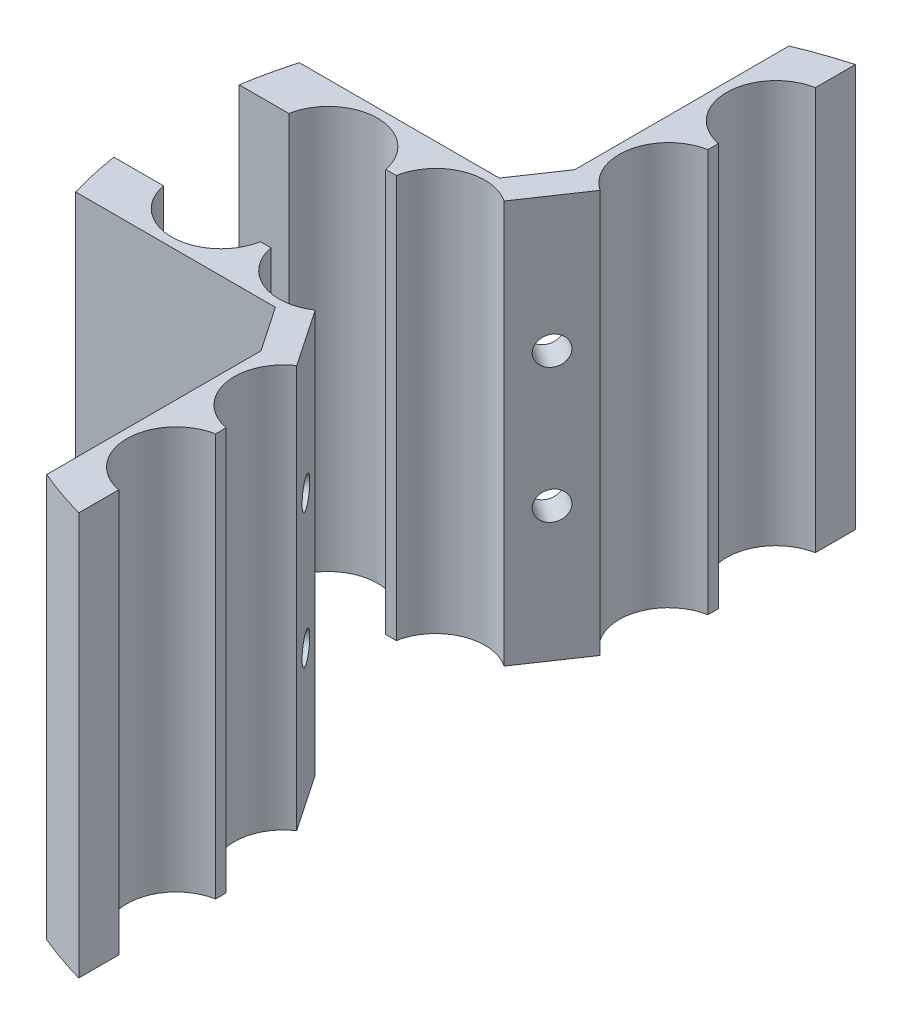
from build123d import *

# Parameters (mm, degrees)
BOSS_EXTRUDE2_DEPTH = 45
SKETCH2_R           = 5.5
CUT_EXTRUDE1_DEPTH  = 45
SKETCH3_W           = 11
SKETCH3_H           = 6
CUT_EXTRUDE2_DEPTH  = 45
SKETCH4_W           = 1
SKETCH4_H           = 1
CUT_EXTRUDE3_DEPTH  = 45
CUT_EXTRUDE4_DEPTH  = 45
SKETCH8_R           = 1.6
CUT_EXTRUDE5_DEPTH  = 45
SKETCH9_R           = 1.6
CUT_EXTRUDE6_DEPTH  = 45


with BuildPart() as part:
    # Sketch1 → Boss-Extrude2 (new body)
    with BuildSketch(Plane(origin=(0, 0, 0), x_dir=(1, 0, 0), z_dir=(0, 1, 0))):
        with BuildLine():
            Line((0, -45), (0, 45))
            ThreePointArc((0, 45), (-45, 0), (0, -45))
        make_face()
    extrude(amount=BOSS_EXTRUDE2_DEPTH)

    # Sketch2 → Cut-Extrude1 (cut)
    with BuildSketch(Plane(origin=(0, 45, 0), x_dir=(1, 0, 0), z_dir=(0, 1, 0))):
        with Locations(Location((-11, -21.5, 0), (0, 0, 270))):
            Circle(SKETCH2_R)
        with Locations(Location((-11, -33.5, 0), (0, 0, 270))):
            Circle(SKETCH2_R)
        with Locations(Location((-21.5, -6, 0), (0, 0, 270))):
            Circle(SKETCH2_R)
        with Locations(Location((-33.5, -6, 0), (0, 0, 270))):
            Circle(SKETCH2_R)
        with Locations(Location((-11, 33.5, 0), (0, 0, 270))):
            Circle(SKETCH2_R)
        with Locations(Location((-11, 21.5, 0), (0, 0, 270))):
            Circle(SKETCH2_R)
        with Locations(Location((-21.5, 6, 0), (0, 0, 270))):
            Circle(SKETCH2_R)
        with Locations(Location((-33.5, 6, 0), (0, 0, 270))):
            Circle(SKETCH2_R)
    extrude(amount=-CUT_EXTRUDE1_DEPTH, mode=Mode.SUBTRACT)

    # Sketch3 → Cut-Extrude2 (cut)
    with BuildSketch(Plane(origin=(0, 45, 0), x_dir=(1, 0, 0), z_dir=(0, 1, 0))):
        with BuildLine():
            Line((-11, 6), (0, 6))
            Line((0, 6), (0, 45))
            ThreePointArc((0, 45), (-5.54219358, 44.657408012), (-11, 43.634848459))
            Line((-11, 43.634848459), (-11, 39))
            ThreePointArc((-11, 39), (-7.110912703, 37.389087297), (-5.5, 33.5))
            ThreePointArc((-5.5, 33.5), (-7.110912703, 29.610912703), (-11, 28))
            Line((-11, 28), (-11, 27))
            ThreePointArc((-11, 27), (-7.110912703, 25.389087297), (-5.5, 21.5))
            ThreePointArc((-5.5, 21.5), (-7.110912703, 17.610912703), (-11, 16))
            Line((-11, 16), (-11, 6))
        make_face()
        with BuildLine():
            Line((0, -45), (0, -6))
            Line((0, -6), (-11, -6))
            Line((-11, -6), (-11, -16))
            ThreePointArc((-11, -16), (-7.110912703, -17.610912703), (-5.5, -21.5))
            ThreePointArc((-5.5, -21.5), (-7.110912703, -25.389087297), (-11, -27))
            Line((-11, -27), (-11, -28))
            ThreePointArc((-11, -28), (-7.110912703, -29.610912703), (-5.5, -33.5))
            ThreePointArc((-5.5, -33.5), (-7.110912703, -37.389087297), (-11, -39))
            Line((-11, -39), (-11, -43.634848459))
            ThreePointArc((-11, -43.634848459), (-5.54219358, -44.657408012), (0, -45))
        make_face()
        with BuildLine():
            Line((-11, -6), (-11, 0))
            Line((-11, 0), (-45, 0))
            ThreePointArc((-45, 0), (-44.8994392, -3.006719068), (-44.598206242, -6))
            Line((-44.598206242, -6), (-39, -6))
            ThreePointArc((-39, -6), (-33.5, -0.5), (-28, -6))
            Line((-28, -6), (-27, -6))
            ThreePointArc((-27, -6), (-21.5, -0.5), (-16, -6))
            Line((-16, -6), (-11, -6))
        make_face()
        with BuildLine():
            Line((-45, 0), (-11, 0))
            Line((-11, 0), (-11, 6))
            Line((-11, 6), (-16, 6))
            ThreePointArc((-16, 6), (-21.5, 0.5), (-27, 6))
            Line((-27, 6), (-28, 6))
            ThreePointArc((-28, 6), (-33.5, 0.5), (-39, 6))
            Line((-39, 6), (-44.598206242, 6))
            ThreePointArc((-44.598206242, 6), (-44.8994392, 3.006719068), (-45, 0))
        make_face()
        with Locations((-5.5, 3)):
            Rectangle(SKETCH3_W, SKETCH3_H)
        with Locations((-5.5, -3)):
            Rectangle(SKETCH3_W, SKETCH3_H)
    extrude(amount=-CUT_EXTRUDE2_DEPTH, mode=Mode.SUBTRACT)


with BuildPart() as cut_extrude2_piece_1:
    # of the separate pieces the step leaves, piece 1, a body of its own (cut_extrude2_pieces)
    add(part.part.solids().sort_by_distance((-44.598206242, 0, 6))[0])


with BuildPart() as cut_extrude2_piece_2:
    # of the separate pieces the step leaves, piece 2, a body of its own (cut_extrude2_pieces)
    add(part.part.solids().sort_by_distance((-11, 0, -43.634848459))[0])


with BuildPart() as cut_extrude3_tool:
    # Sketch4 → Cut-Extrude3 (new body)
    with BuildSketch(Plane(origin=(0, 45, 0), x_dir=(1, 0, 0), z_dir=(0, 1, 0))):
        Polygon((-48.017715624, 6), (-21.5, 6), (-20.822580645, 7), (-48.017715624, 7), align=None)
        Polygon((-20.822580645, 7), (-21.5, 6), (-12, 6), (-12, 7), align=None)
        Polygon((-12, 20.023809524), (-20.822580645, 7), (-12, 7), align=None)
        with Locations((-11.5, 6.5)):
            Rectangle(SKETCH4_W, SKETCH4_H)
        Polygon((-12, 46.611751928), (-12, 20.023809524), (-11, 21.5), (-11, 46.611751928), align=None)
        Polygon((-11, 21.5), (-12, 20.023809524), (-12, 7), (-11, 7), align=None)
        Polygon((-12, -46.611751928), (-11, -46.611751928), (-11, -21.5), (-12, -20.023809524), align=None)
        Polygon((-12, -20.023809524), (-11, -21.5), (-11, -7), (-12, -7), align=None)
        Polygon((-20.822580645, -7), (-12, -20.023809524), (-12, -7), align=None)
        with Locations((-11.5, -6.5)):
            Rectangle(SKETCH4_W, SKETCH4_H)
        Polygon((-20.822580645, -7), (-12, -7), (-12, -6), (-21.5, -6), align=None)
        Polygon((-48.017715624, -7), (-20.822580645, -7), (-21.5, -6), (-48.017715624, -6), align=None)
    extrude(amount=-CUT_EXTRUDE3_DEPTH)


with BuildPart() as cut_extrude2_piece_1_1:
    add(cut_extrude2_piece_1.part)

    # Cut-Extrude3: cut by cut_extrude3_tool
    add(cut_extrude3_tool.part, mode=Mode.SUBTRACT)


with BuildPart() as cut_extrude2_piece_2_1:
    add(cut_extrude2_piece_2.part)

    # Cut-Extrude3: cut by cut_extrude3_tool
    add(cut_extrude3_tool.part, mode=Mode.SUBTRACT)


with BuildPart() as cut_extrude4_tool:
    # Sketch5 → Cut-Extrude4 (new body)
    with BuildSketch(Plane(origin=(0, 45, 0), x_dir=(1, 0, 0), z_dir=(0, 1, 0))):
        Polygon((-43.229041164, 12.5), (-20.908343915, 12.5), (-17.5, 17.531517582), (-17.5, 41.457809879), (-43.229041164, 41.457809879), align=None)
        Polygon((-20.908343915, -12.5), (-43.229041164, -12.5), (-43.229041164, -41.457809879), (-17.5, -41.457809879), (-17.5, -17.531517582), align=None)
    extrude(amount=-CUT_EXTRUDE4_DEPTH)


with BuildPart() as cut_extrude2_piece_1_2:
    add(cut_extrude2_piece_1_1.part)

    # Cut-Extrude4: cut by cut_extrude4_tool
    add(cut_extrude4_tool.part, mode=Mode.SUBTRACT)

    # Sketch8 → Cut-Extrude5 (cut)
    with BuildSketch(Plane(origin=(-17.52318117, 0, 11.870542083), x_dir=(-0.5608481451695153, 0, -0.827918690488332), z_dir=(0.827918690488332, 0, -0.5608481451695153))):
        with Locations((-2.270099635, 15)):
            Circle(SKETCH8_R)
        with Locations((-2.270099635, 30)):
            Circle(SKETCH8_R)
    extrude(amount=-CUT_EXTRUDE5_DEPTH, mode=Mode.SUBTRACT)


with BuildPart() as cut_extrude2_piece_2_2:
    add(cut_extrude2_piece_2_1.part)

    # Cut-Extrude4: cut by cut_extrude4_tool
    add(cut_extrude4_tool.part, mode=Mode.SUBTRACT)

    # Sketch9 → Cut-Extrude6 (cut)
    with BuildSketch(Plane(origin=(-17.52318117, 0, -11.870542083), x_dir=(0.5608481451695153, 0, -0.827918690488332), z_dir=(0.827918690488332, 0, 0.5608481451695153))):
        with Locations((2.270099635, 30)):
            Circle(SKETCH9_R)
        with Locations((2.270099635, 15)):
            Circle(SKETCH9_R)
    extrude(amount=-CUT_EXTRUDE6_DEPTH, mode=Mode.SUBTRACT)


solid = Compound([cut_extrude2_piece_1_2.part, cut_extrude2_piece_2_2.part])
